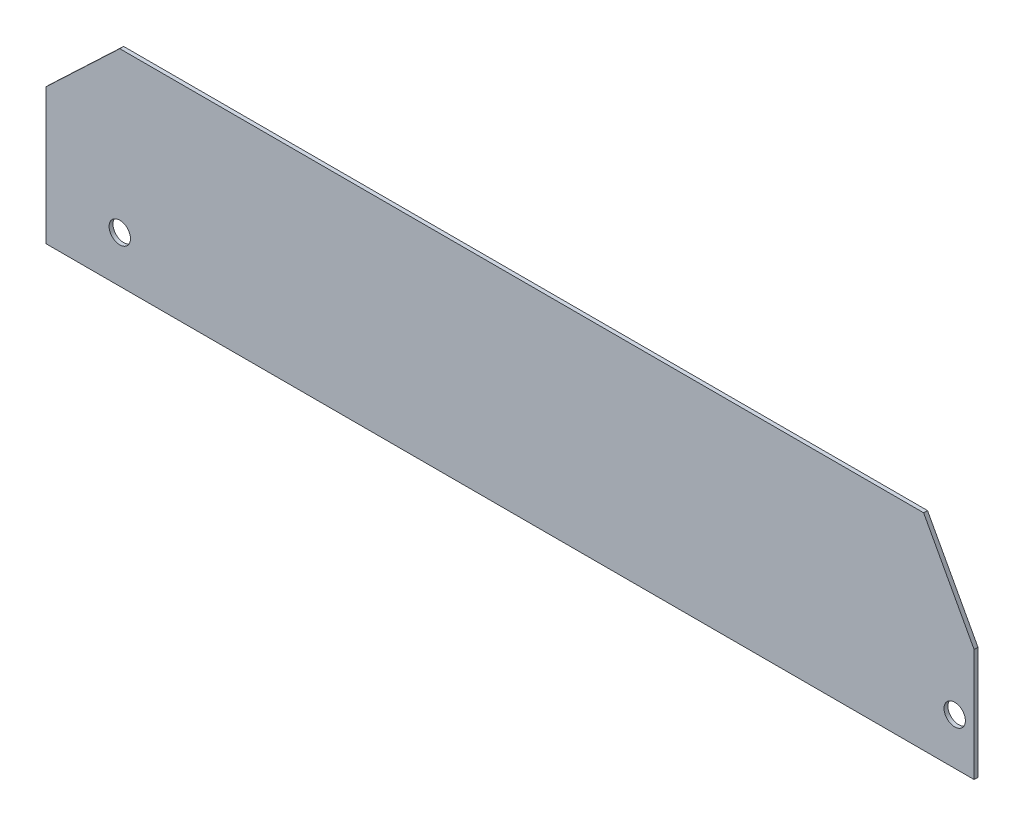
from build123d import *

# Parameters (mm, degrees)
SIDE_WALL_WITH_M5_ATTACHMENTS_PROFILE_R = 2.75
SIDE_WALL_WITH_M5_ATTACHMENTS_DEPTH     = 1


with BuildPart() as part:
    # Side wall with M5 attachments profile → Side wall with M5 attachments (new body)
    with BuildSketch(Plane.XY):
        Polygon((-136, 7), (103, 7), (103, 36), (90, 60), (-117, 60), (-136, 42), align=None)
        with Locations((-117, 19)):
            Circle(SIDE_WALL_WITH_M5_ATTACHMENTS_PROFILE_R, mode=Mode.SUBTRACT)
        with Locations((98, 19)):
            Circle(SIDE_WALL_WITH_M5_ATTACHMENTS_PROFILE_R, mode=Mode.SUBTRACT)
    extrude(amount=SIDE_WALL_WITH_M5_ATTACHMENTS_DEPTH)


solid = part.part
